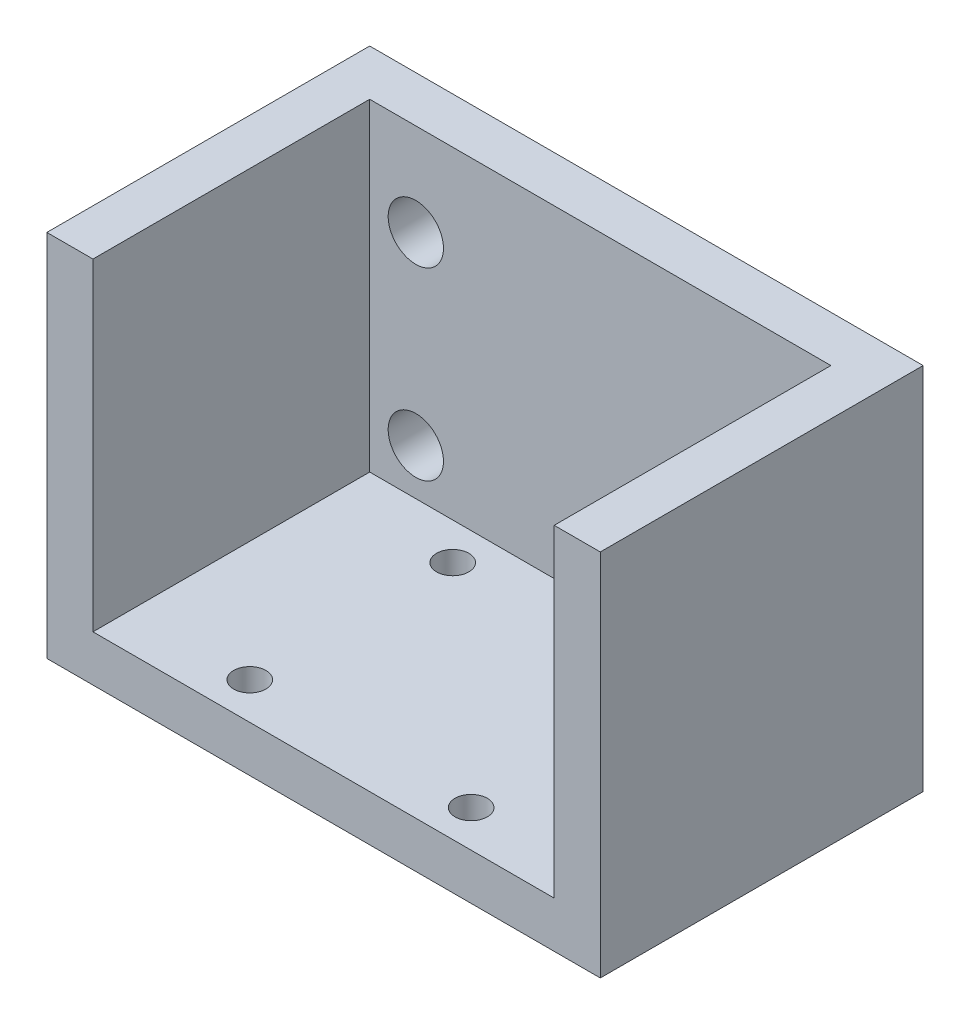
from build123d import *

# Parameters (mm, degrees)
SKETCH_1_W          = 60
SKETCH_1_H          = 35
EXTRUDE_1_DEPTH     = 5
EXTRUDE_2_DEPTH     = 35
SKETCH_4_R          = 3
CUT_EXTRUDE_1_DEPTH = 5
SKETCH_5_R          = 1.75
CUT_EXTRUDE_2_DEPTH = 5


with BuildPart() as part:
    # Эскиз1 → Бобышка-Вытянуть1 (new body)
    with BuildSketch(Plane(origin=(0, 0, 0), x_dir=(1, 0, 0), z_dir=(0, 1, 0))):
        with Locations((30, 17.5)):
            Rectangle(SKETCH_1_W, SKETCH_1_H)
    extrude(amount=EXTRUDE_1_DEPTH)

    # Эскиз3 → Бобышка-Вытянуть2 (add)
    with BuildSketch(Plane(origin=(0, 5, 0), x_dir=(1, 0, 0), z_dir=(0, 1, 0))):
        Polygon((5, 30), (55, 30), (55, 0), (60, 0), (60, 35), (0, 35), (0, 0), (5, 0), align=None)
    extrude(amount=EXTRUDE_2_DEPTH)

    # Эскиз4 → Вырез-Вытянуть1 (cut)
    with BuildSketch(Plane(origin=(0, 0, -35), x_dir=(-1, 0, 0), z_dir=(0, 0, -1))):
        with Locations((-10, 10)):
            Circle(SKETCH_4_R)
        with Locations((-10, 30)):
            Circle(SKETCH_4_R)
        with Locations((-50, 30)):
            Circle(SKETCH_4_R)
        with Locations((-50, 10)):
            Circle(SKETCH_4_R)
    extrude(amount=-CUT_EXTRUDE_1_DEPTH, mode=Mode.SUBTRACT)

    # Эскиз5 → Вырез-Вытянуть2 (cut)
    with BuildSketch(Plane(origin=(0, 0, 0), x_dir=(-1, 0, 0), z_dir=(0, -1, 0))):
        with Locations(Location((-42, 26, 0), (0, 0, 90))):
            Circle(SKETCH_5_R)
        with Locations(Location((-18, 26, 0), (0, 0, 90))):
            Circle(SKETCH_5_R)
        with Locations(Location((-18, 4, 0), (0, 0, 90))):
            Circle(SKETCH_5_R)
        with Locations(Location((-42, 4, 0), (0, 0, 90))):
            Circle(SKETCH_5_R)
    extrude(amount=-CUT_EXTRUDE_2_DEPTH, mode=Mode.SUBTRACT)


solid = part.part
